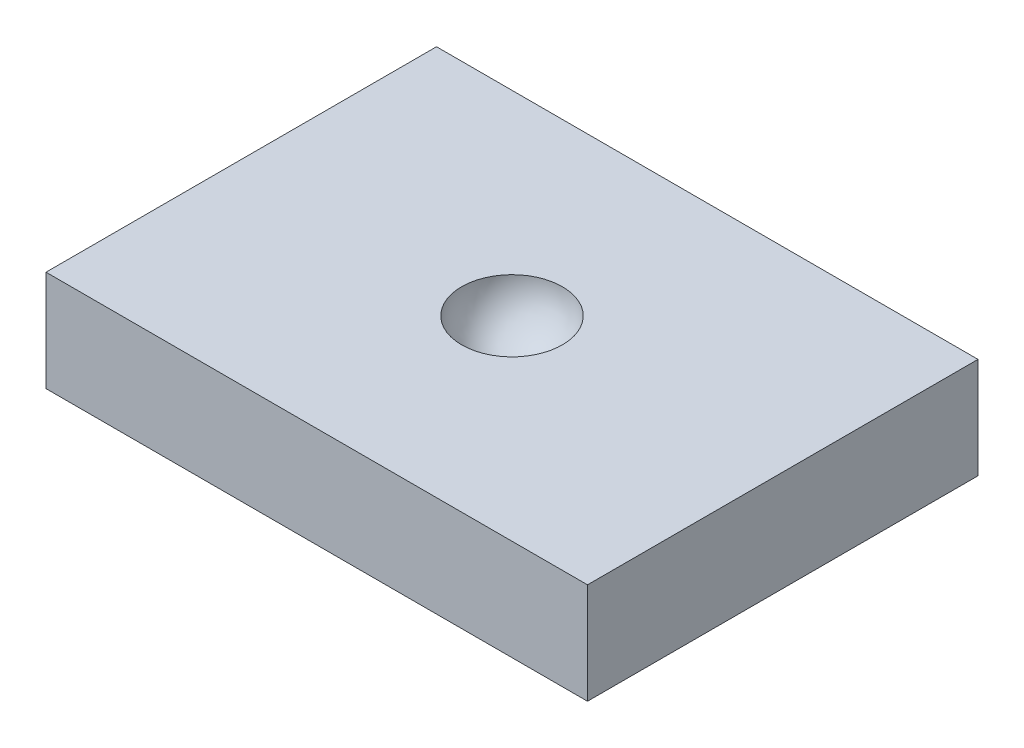
from build123d import *

# Parameters (mm, degrees)
ESQUISSE1_W        = 26.847127718
ESQUISSE1_H        = 19.360909412
BOSS_EXTRU_1_DEPTH = 5


with BuildPart() as part:
    # Esquisse1 → Boss.-Extru.1 (new body)
    with BuildSketch(Plane(origin=(0, 0, 0), x_dir=(1, 0, 0), z_dir=(0, 1, 0))):
        with Locations((-13.423563859, 9.680454706)):
            Rectangle(ESQUISSE1_W, ESQUISSE1_H)
    extrude(amount=BOSS_EXTRU_1_DEPTH)

    # Esquisse2 → Enlèvement de matière-Révolution1 (revolve, cut)
    with BuildSketch(Plane(origin=(0, 5, 0), x_dir=(1, 0, 0), z_dir=(0, 1, 0))):
        with BuildLine():
            Line((-13.423563859, 12.17807818), (-13.423563859, 7.182831232))
            ThreePointArc((-13.423563859, 7.182831232), (-10.925940385, 9.680454706), (-13.423563859, 12.17807818))
        make_face()
    revolve(axis=Axis((-13.423563859, 5, -17.260196432), (0, 0, 1)), mode=Mode.SUBTRACT)


solid = part.part
